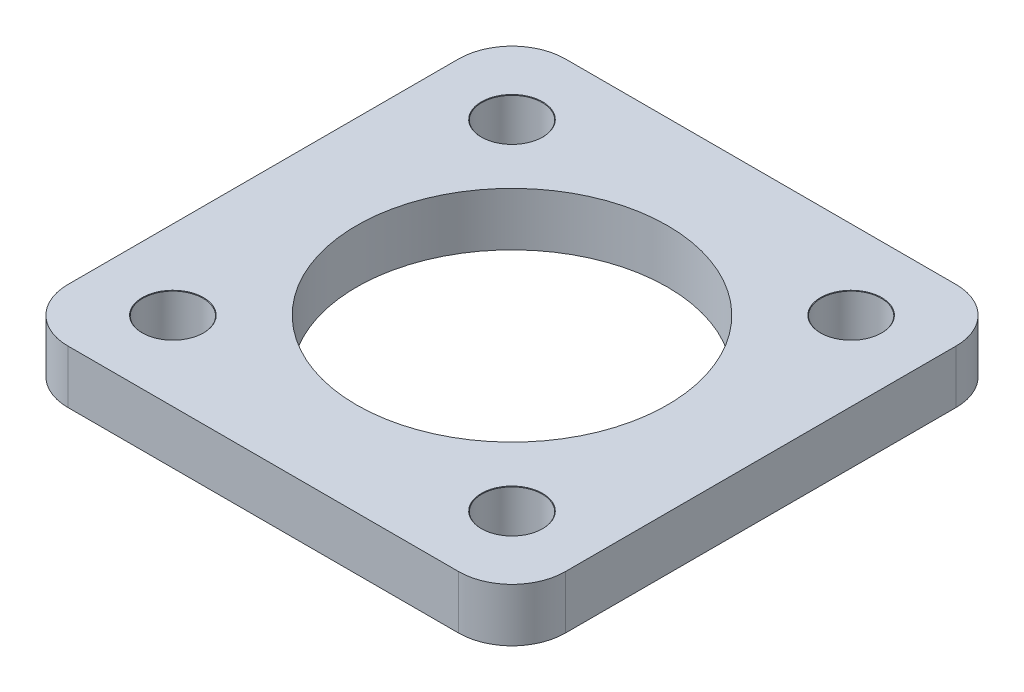
from build123d import *

# Parameters (mm, degrees)
SKETCH1_W                      = 28
SKETCH1_H                      = 28
BOSS_EXTRUDE1_DEPTH            = 3
SKETCH2_R                      = 8.75
CUT_EXTRUDE1_DEPTH             = 21.024984395
M3_CLEARANCE_HOLE1_D           = 3.4
M3_CLEARANCE_HOLE1_CSINK_D     = 3.45
M3_CLEARANCE_HOLE1_CSINK_ANGLE = 90
FILLET1_R                      = 3


with BuildPart() as part:
    # Sketch1 → Boss-Extrude1 (new body)
    with BuildSketch(Plane(origin=(0, 0, 0), x_dir=(1, 0, 0), z_dir=(0, 1, 0))):
        Rectangle(SKETCH1_W, SKETCH1_H)
    extrude(amount=BOSS_EXTRUDE1_DEPTH)

    # Sketch2 → Cut-Extrude1 (cut, through all)
    with BuildSketch(Plane(origin=(0, 3, 0), x_dir=(1, 0, 0), z_dir=(0, 1, 0))):
        with Locations(Location((0, 0, 0), (0, 0, 270))):
            Circle(SKETCH2_R)
    extrude(amount=-CUT_EXTRUDE1_DEPTH, mode=Mode.SUBTRACT)

    # M3 Clearance Hole1 (through all)
    with Locations(Plane(origin=(0, 3, 0), x_dir=(1, 0, 0), z_dir=(0, 1, 0))):
        with Locations((-9.545941546, 9.545941546), (9.545941546, 9.545941546), (9.545941546, -9.545941546), (-9.545941546, -9.545941546)):
            CounterSinkHole(M3_CLEARANCE_HOLE1_D / 2, M3_CLEARANCE_HOLE1_CSINK_D / 2, counter_sink_angle=M3_CLEARANCE_HOLE1_CSINK_ANGLE)

    # Fillet1
    fillet1_edges = [part.edges().sort_by_distance(p)[0] for p in [
        (-14, 1.5, -14),
        (14, 1.5, -14),
        (14, 1.5, 14),
        (-14, 1.5, 14),
    ]]
    fillet(fillet1_edges, radius=FILLET1_R)


solid = part.part
